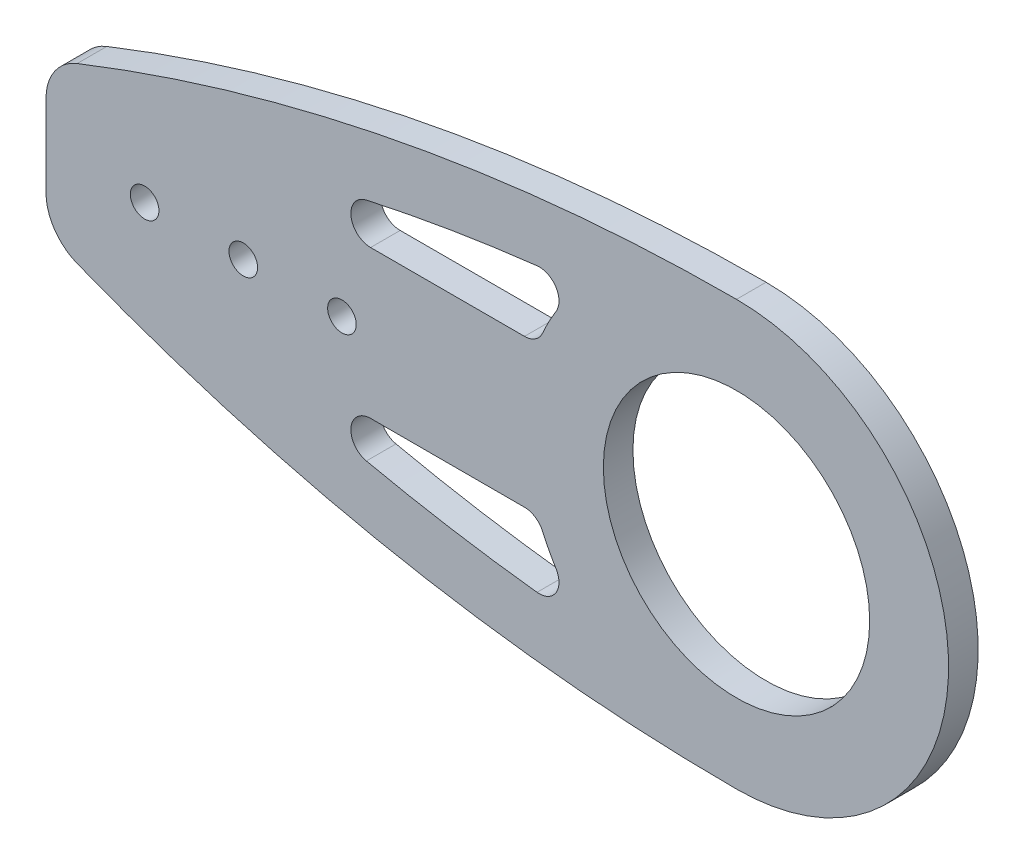
from build123d import *

# Parameters (mm, degrees)
SKETCH_1_R          = 13.5
EXTRUDE_1_DEPTH     = 3
SKETCH_2_R          = 1.45
CUT_EXTRUDE_1_DEPTH = 58.750135626
FILLET_1_R          = 5
CUT_EXTRUDE_2_DEPTH = 58.750135626
FILLET_2_R          = 2


with BuildPart() as part:
    # 草图1 → 凸台-拉伸1 (new body)
    with BuildSketch(Plane.XY):
        with BuildLine():
            Line((-49.85055832, 0), (-49.85055832, -15))
            ThreePointArc((-49.85055832, -15), (-15.543694916, -25.465682976), (20.14944168, -29))
            ThreePointArc((20.14944168, -29), (41.64944168, -7.5), (20.14944168, 14))
            ThreePointArc((20.14944168, 14), (-15.543694916, 10.465682976), (-49.85055832, 0))
        make_face()
        with Locations((20.14944168, -7.5)):
            Circle(SKETCH_1_R, mode=Mode.SUBTRACT)
    extrude(amount=EXTRUDE_1_DEPTH)

    # 草图2 → 切除-拉伸1 (cut, through all)
    with BuildSketch(Plane.XY.offset(3)):
        with Locations((-39.85055832, -7.5)):
            Circle(SKETCH_2_R)
        with Locations((-29.85055832, -7.5)):
            Circle(SKETCH_2_R)
        with Locations((-19.85055832, -7.5)):
            Circle(SKETCH_2_R)
    extrude(amount=-CUT_EXTRUDE_1_DEPTH, mode=Mode.SUBTRACT)

    # 圆角1
    fillet_1_edges = [part.edges().sort_by_distance(p)[0] for p in [
        (-49.85055832, -15, 1.5),
        (-49.85055832, 0, 1.5),
    ]]
    fillet(fillet_1_edges, radius=FILLET_1_R)

    # 草图3 → 切除-拉伸2 (cut, through all)
    with BuildSketch(Plane.XY.offset(3)):
        with BuildLine():
            Line((-32.310066515, 0), (0, 0))
            ThreePointArc((0, 0), (1.911289465, 3.885069336), (4.562236757, 7.308411215))
            ThreePointArc((4.562236757, 7.308411215), (-14.069588262, 4.641414469), (-32.310066515, 0))
        make_face()
        with BuildLine():
            Line((-32.310066515, -15), (0, -15))
            ThreePointArc((0, -15), (1.911289465, -18.885069336), (4.562236757, -22.308411215))
            ThreePointArc((4.562236757, -22.308411215), (-14.069588262, -19.641414469), (-32.310066515, -15))
        make_face()
    extrude(amount=-CUT_EXTRUDE_2_DEPTH, mode=Mode.SUBTRACT)

    # 圆角2
    fillet_2_edges = [part.edges().sort_by_distance(p)[0] for p in [
        (0, -15, 1.5),
        (4.562236757, -22.308411215, 1.5),
        (-32.310066515, -15, 1.5),
        (4.562236757, 7.308411215, 1.5),
        (0, 0, 1.5),
        (-32.310066515, 0, 1.5),
    ]]
    fillet(fillet_2_edges, radius=FILLET_2_R)


solid = part.part
